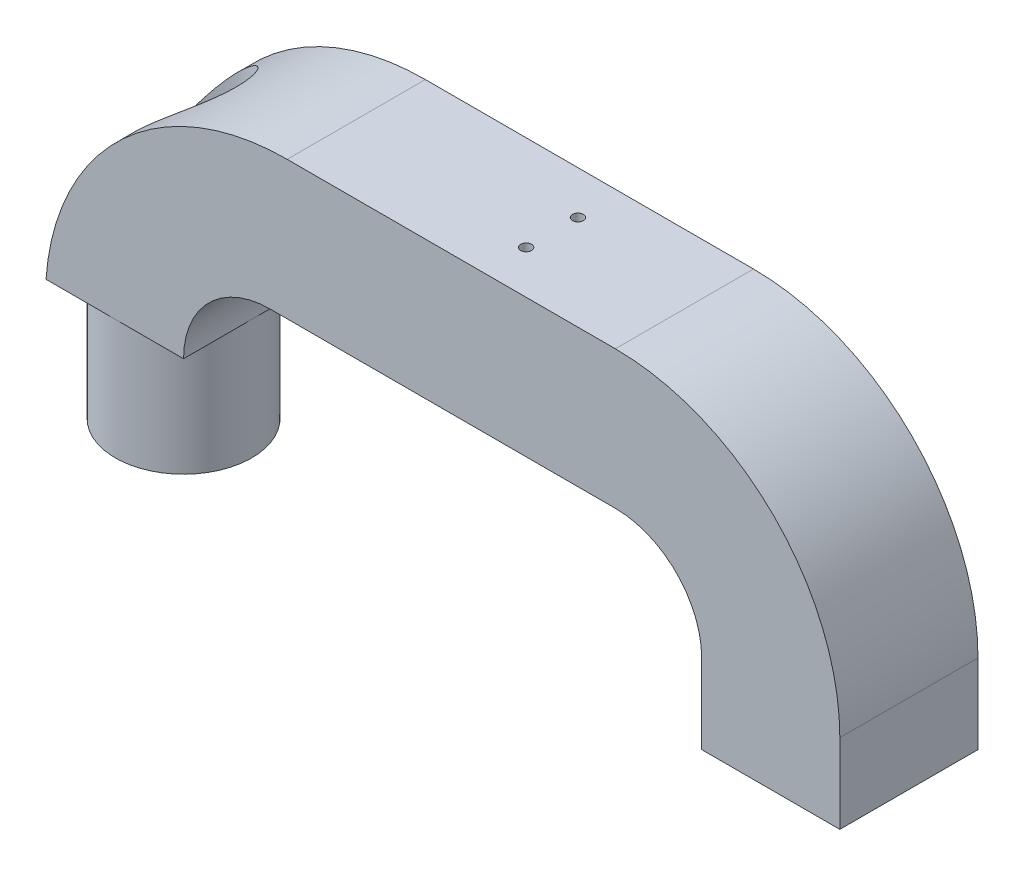
from build123d import *

# Parameters (mm, degrees)
BOSS_EXTRUDE1_DEPTH     = 80
SKETCH5_R               = 59.5
SKETCH5_R_2             = 39.5
CUT_EXTRUDE_THIN2_DEPTH = 70
SKETCH6_R               = 30.5
CUT_EXTRUDE9_DEPTH      = 508.937003968
F_3_0MM_DOWEL_HOLE1_D   = 6.3


with BuildPart() as part:
    # Sketch1 → Boss-Extrude1 (new body)
    with BuildSketch(Plane.XY):
        with BuildLine():
            Line((0, 0), (80, 0))
            Line((80, 0), (80, 70))
            ThreePointArc((80, 70), (94.644660941, 105.355339059), (130, 120))
            Line((130, 120), (235, 120))
            Line((235, 120), (330, 120))
            ThreePointArc((330, 120), (365.355339059, 105.355339059), (380, 70))
            Line((380, 70), (380, 24))
            Line((380, 24), (460, 24))
            Line((460, 24), (460, 70))
            ThreePointArc((460, 70), (421.923881554, 161.923881554), (330, 200))
            Line((330, 200), (140, 200))
            ThreePointArc((140, 200), (41.005050634, 158.994949366), (0, 60))
            Line((0, 60), (0, 0))
        make_face()
    extrude(amount=BOSS_EXTRUDE1_DEPTH)

    # Sketch5 → Cut-Extrude-Thin2 (cut)
    with BuildSketch(Plane.XZ):
        with Locations((40, 40)):
            Circle(SKETCH5_R)
        with Locations((40, 40)):
            Circle(SKETCH5_R_2, mode=Mode.SUBTRACT)
    extrude(amount=-CUT_EXTRUDE_THIN2_DEPTH, mode=Mode.SUBTRACT)

    # Sketch6 → Cut-Extrude9 (cut, through all)
    with BuildSketch(Plane.XZ):
        with Locations(Location((40, 40, 0), (0, 0, 270))):
            Circle(SKETCH6_R)
    extrude(amount=-CUT_EXTRUDE9_DEPTH, mode=Mode.SUBTRACT)

    # Ø3.0mm Dowel Hole1 (through all)
    with Locations(Plane(origin=(253.35, 200, 55), x_dir=(0, 0, 1), z_dir=(0, 1, 0))):
        with Locations((0, 0), (-30, 0)):
            Hole(F_3_0MM_DOWEL_HOLE1_D / 2)


solid = part.part
